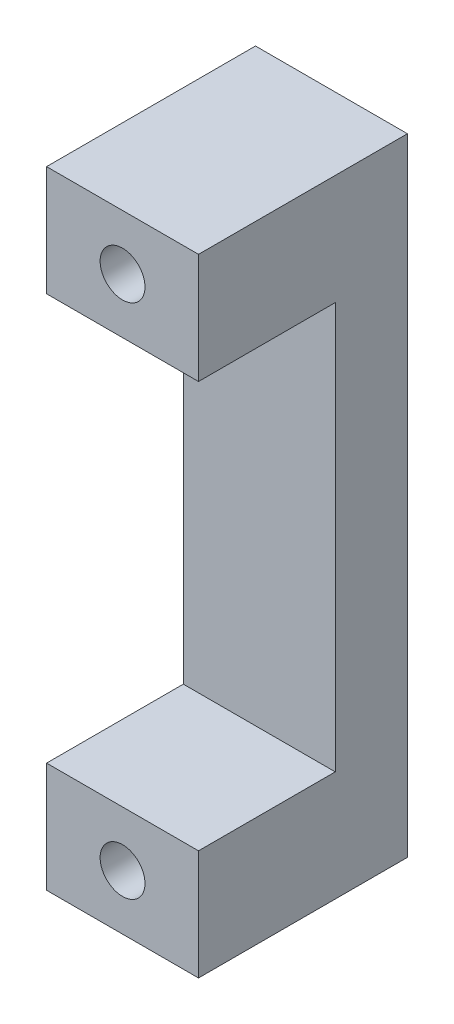
from build123d import *

# Parameters (mm, degrees)
SKETCH1_W             = 10.16
SKETCH1_H             = 41.91
BOSS_EXTRUDE1_DEPTH   = 13.97
SKETCH2_W             = 10.16
SKETCH2_H             = 27.178
CUT_EXTRUDE1_DEPTH    = 9.144
F_3_0MM_DOWEL_HOLE1_D = 3


with BuildPart() as part:
    # Sketch1 → Boss-Extrude1 (new body)
    with BuildSketch(Plane.XY):
        with Locations((5.08, 20.955)):
            Rectangle(SKETCH1_W, SKETCH1_H)
    extrude(amount=BOSS_EXTRUDE1_DEPTH)

    # Sketch2 → Cut-Extrude1 (cut)
    with BuildSketch(Plane.XY.offset(13.97)):
        with Locations((5.08, 20.955)):
            Rectangle(SKETCH2_W, SKETCH2_H)
    extrude(amount=-CUT_EXTRUDE1_DEPTH, mode=Mode.SUBTRACT)

    # Ø3.0mm Dowel Hole1 (through all)
    with Locations(Plane.XY.offset(13.97)):
        with Locations((5.08, 3.683), (5.08, 38.227)):
            Hole(F_3_0MM_DOWEL_HOLE1_D / 2)


solid = part.part
